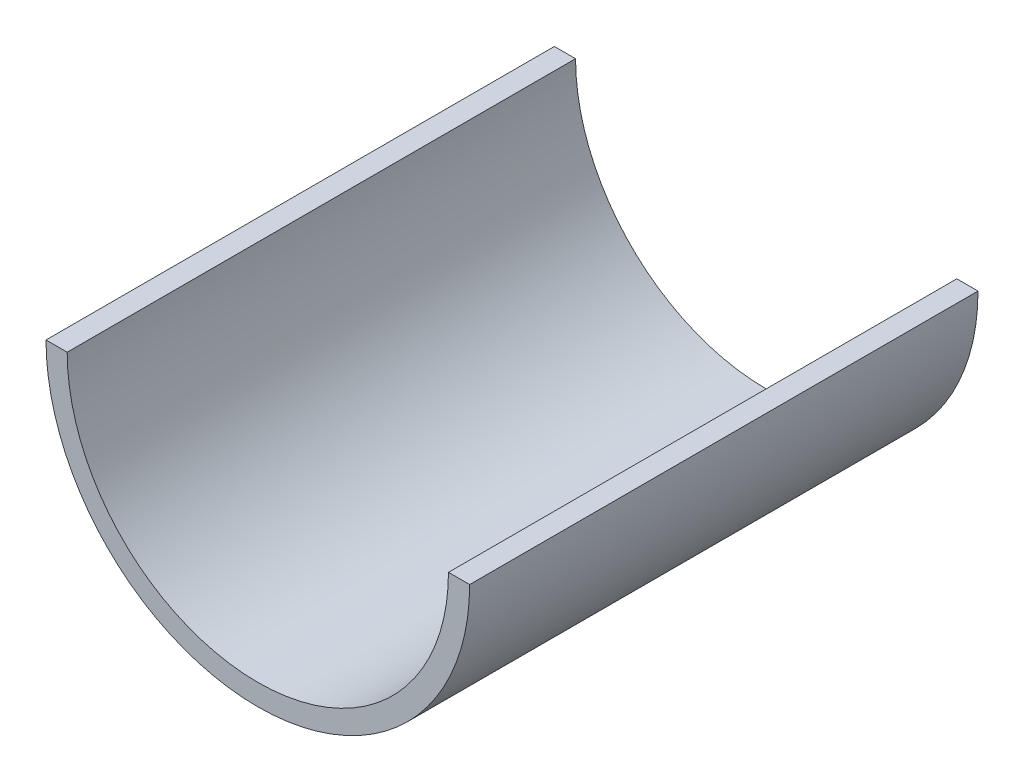
from build123d import *

# Parameters (mm, degrees)
BOSS_EXTRUDE1_DEPTH = 152.4


with BuildPart() as part:
    # Sketch1 → Boss-Extrude1 (new body)
    with BuildSketch(Plane.XY):
        with BuildLine():
            Line((-63.5, 0), (-57.15, 0))
            ThreePointArc((-57.15, 0), (0, -57.15), (57.15, 0))
            Line((57.15, 0), (63.5, 0))
            ThreePointArc((63.5, 0), (0, -63.5), (-63.5, 0))
        make_face()
    extrude(amount=BOSS_EXTRUDE1_DEPTH)


solid = part.part
